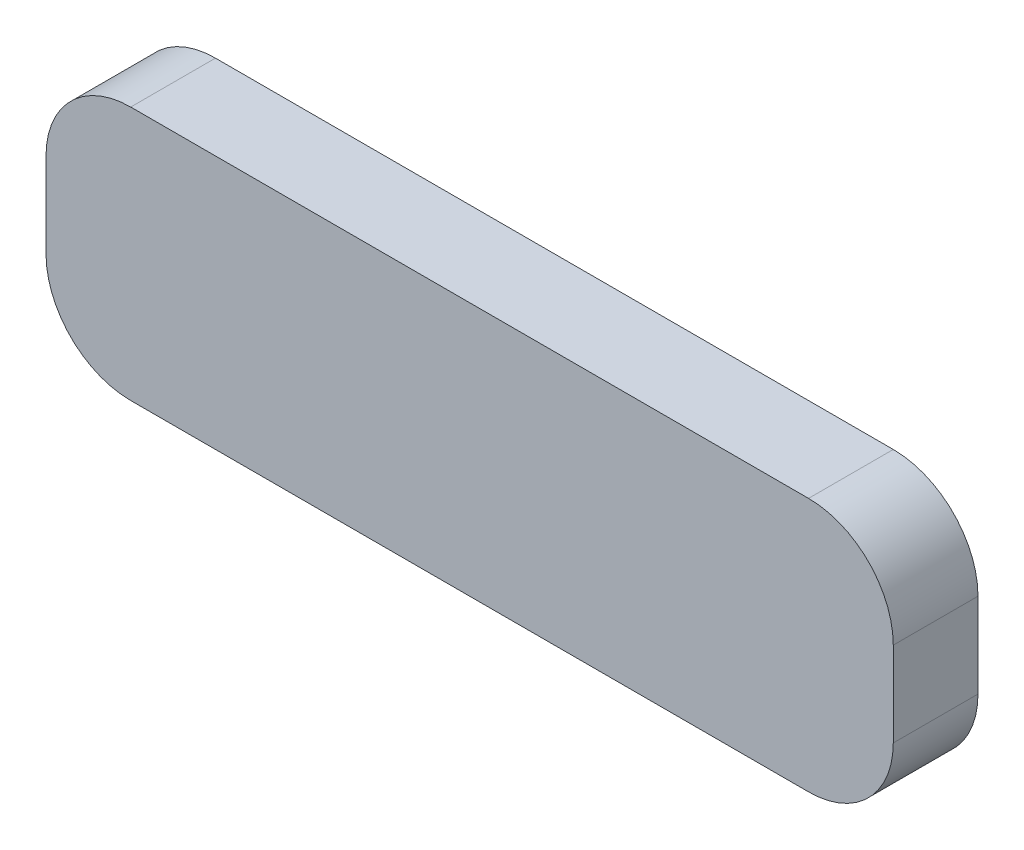
from build123d import *

# Parameters (mm, degrees)
BOSS_EXTRUDE1_DEPTH = 10


with BuildPart() as part:
    # Sketch2 → Boss-Extrude1 (new body)
    with BuildSketch(Plane.XY):
        with BuildLine():
            Line((10, 0), (90, 0))
            ThreePointArc((90, 0), (97.071067812, 2.928932188), (100, 10))
            Line((100, 10), (100, 20))
            ThreePointArc((100, 20), (97.071067812, 27.071067812), (90, 30))
            Line((90, 30), (10, 30))
            ThreePointArc((10, 30), (2.928932188, 27.071067812), (0, 20))
            Line((0, 20), (0, 10))
            ThreePointArc((0, 10), (2.928932188, 2.928932188), (10, 0))
        make_face()
    extrude(amount=BOSS_EXTRUDE1_DEPTH)


solid = part.part
